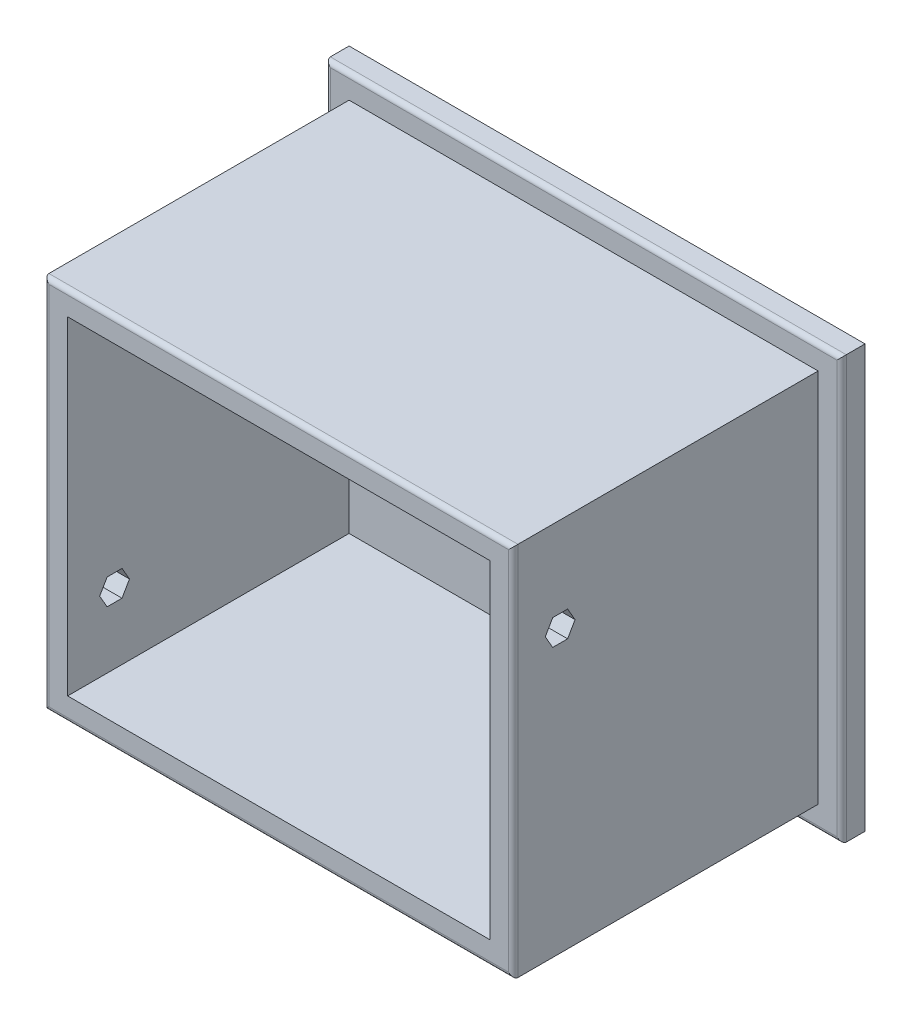
from build123d import *

# Parameters (mm, degrees)
ESQUISSE1_W             = 110
ESQUISSE1_H             = 90
ESQUISSE1_W_2           = 100
ESQUISSE1_H_2           = 80
BOSS_EXTRU_1_DEPTH      = 5
ESQUISSE1_32_W          = 100
ESQUISSE1_32_H          = 80
ESQUISSE1_32_W_2        = 90
ESQUISSE1_32_H_2        = 70
BOSS_EXTRU_2_DEPTH      = 70
ESQUISSE1_33_W          = 90
ESQUISSE1_33_H          = 70
BOSS_EXTRU_3_DEPTH      = 10
ENL_V_MAT_EXTRU_3_DEPTH = 10
ENL_V_MAT_EXTRU_4_DEPTH = 10
CONG_1_R                = 1
CONG_2_R                = 1


with BuildPart() as part:
    # Esquisse1 → Boss.-Extru.1 (new body)
    with BuildSketch(Plane.XY):
        with Locations((-53.377032771, -27.155018472)):
            Rectangle(ESQUISSE1_W, ESQUISSE1_H)
        with Locations((-53.377032771, -27.155018472)):
            Rectangle(ESQUISSE1_W_2, ESQUISSE1_H_2, mode=Mode.SUBTRACT)
    extrude(amount=BOSS_EXTRU_1_DEPTH)

    # Esquisse1<32> → Boss.-Extru.2 (add)
    with BuildSketch(Plane.XY):
        with Locations((-53.377032771, -27.155018472)):
            Rectangle(ESQUISSE1_32_W, ESQUISSE1_32_H)
        with Locations((-53.377032771, -27.155018472)):
            Rectangle(ESQUISSE1_32_W_2, ESQUISSE1_32_H_2, mode=Mode.SUBTRACT)
    extrude(amount=BOSS_EXTRU_2_DEPTH)

    # Esquisse1<33> → Boss.-Extru.3 (add)
    with BuildSketch(Plane.XY):
        with Locations((-53.377032771, -27.155018472)):
            Rectangle(ESQUISSE1_33_W, ESQUISSE1_33_H)
    extrude(amount=BOSS_EXTRU_3_DEPTH)

    # Esquisse11 → Enlèv. mat.-Extru.3 (cut)
    with BuildSketch(Plane(origin=(-3.377032771, 0, 0), x_dir=(0, 0, -1), z_dir=(1, 0, 0))):
        Polygon((-56.824573519, -7.155018472), (-58.41228676, -4.405018472), (-61.58771324, -4.405018472), (-63.175426481, -7.155018472), (-61.58771324, -9.905018472), (-58.41228676, -9.905018472), align=None)
    extrude(amount=-ENL_V_MAT_EXTRU_3_DEPTH, mode=Mode.SUBTRACT)

    # Esquisse13 → Enlèv. mat.-Extru.4 (cut)
    with BuildSketch(Plane.ZY.offset(103.377032771)):
        Polygon((63.175426481, -47.155018472), (61.58771324, -44.405018472), (58.41228676, -44.405018472), (56.824573519, -47.155018472), (58.41228676, -49.905018472), (61.58771324, -49.905018472), align=None)
    extrude(amount=-ENL_V_MAT_EXTRU_4_DEPTH, mode=Mode.SUBTRACT)

    # Congé1
    cong_1_edges = [part.edges().sort_by_distance(p)[0] for p in [
        (-53.377032771, -67.155018472, 70),
        (-3.377032771, -27.155018472, 70),
        (-53.377032771, 12.844981528, 70),
        (-103.377032771, -27.155018472, 70),
    ]]
    fillet(cong_1_edges, radius=CONG_1_R)

    # Congé2
    cong_2_edges = [part.edges().sort_by_distance(p)[0] for p in [
        (1.622967229, -27.155018472, 5),
        (-53.377032771, 17.844981528, 5),
        (-108.377032771, -27.155018472, 5),
        (-53.377032771, -72.155018472, 5),
    ]]
    fillet(cong_2_edges, radius=CONG_2_R)


solid = part.part
